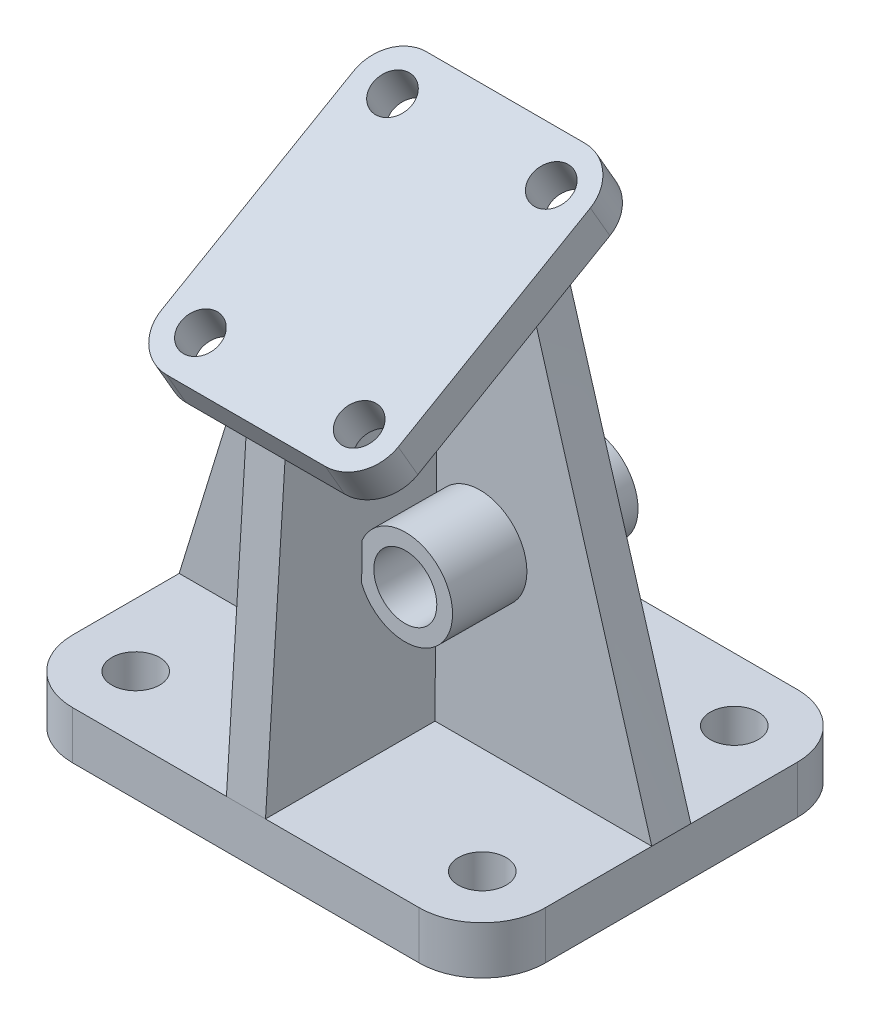
from build123d import *

# Parameters (mm, degrees)
SKETCH7_R           = 4.826
BOSS_EXTRUDE2_DEPTH = 9.652
SKETCH11_R          = 3.937
BOSS_EXTRUDE3_DEPTH = 7.874
RIB1_REACH          = 117.25
SKETCH16_WALL_W     = 293.372991472
SKETCH16_WALL_H     = 7.874
SKETCH17_R          = 9.525
SKETCH17_R_2        = 6.35
BOSS_EXTRUDE4_DEPTH = 14.986
SKETCH18_R          = 9.525
SKETCH18_R_2        = 6.35
BOSS_EXTRUDE5_DEPTH = 14.986


with BuildPart() as part:
    # Sketch7 → Boss-Extrude2 (new body)
    with BuildSketch(Plane(origin=(0, 0, 0), x_dir=(1, 0, 0), z_dir=(0, 1, 0))):
        with BuildLine():
            Line((-34.925, 38.1), (34.925, 38.1))
            ThreePointArc((34.925, 38.1), (43.905256121, 34.380256121), (47.625, 25.4))
            Line((47.625, 25.4), (47.625, -25.4))
            ThreePointArc((47.625, -25.4), (43.905256121, -34.380256121), (34.925, -38.1))
            Line((34.925, -38.1), (-34.925, -38.1))
            ThreePointArc((-34.925, -38.1), (-43.905256121, -34.380256121), (-47.625, -25.4))
            Line((-47.625, -25.4), (-47.625, 25.4))
            ThreePointArc((-47.625, 25.4), (-43.905256121, 34.380256121), (-34.925, 38.1))
        make_face()
        with Locations(Location((-34.925, 25.4, 0), (0, 0, 270))):
            Circle(SKETCH7_R, mode=Mode.SUBTRACT)
        with Locations(Location((34.925, 25.4, 0), (0, 0, 90))):
            Circle(SKETCH7_R, mode=Mode.SUBTRACT)
        with Locations(Location((34.925, -25.4, 0), (0, 0, 270))):
            Circle(SKETCH7_R, mode=Mode.SUBTRACT)
        with Locations(Location((-34.925, -25.4, 0), (0, 0, 90))):
            Circle(SKETCH7_R, mode=Mode.SUBTRACT)
    extrude(amount=-BOSS_EXTRUDE2_DEPTH)



with BuildPart() as body_2:
    # Sketch11 → Boss-Extrude3 (new body)
    with BuildSketch(Plane(origin=(0, 67.170783942, 38.781070191), x_dir=(0, 0.4999999999999983, -0.8660254037844396), z_dir=(0, -0.8660254037844396, -0.4999999999999983))):
        with BuildLine():
            Line((53.364432116, -23.876), (8.660432116, -23.876))
            ThreePointArc((8.660432116, -23.876), (3.092673321, -21.569758795), (0.786432116, -16.002))
            Line((0.786432116, -16.002), (0.786432116, 16.002))
            ThreePointArc((0.786432116, 16.002), (3.092673321, 21.569758795), (8.660432116, 23.876))
            Line((8.660432116, 23.876), (53.364432116, 23.876))
            ThreePointArc((53.364432116, 23.876), (58.932190911, 21.569758795), (61.238432116, 16.002))
            Line((61.238432116, 16.002), (61.238432116, -16.002))
            ThreePointArc((61.238432116, -16.002), (58.932190911, -21.569758795), (53.364432116, -23.876))
        make_face()
        with Locations((53.364432116, -16.002)):
            Circle(SKETCH11_R, mode=Mode.SUBTRACT)
        with Locations(Location((8.660432116, -16.002, 0), (0, 0, 180))):
            Circle(SKETCH11_R, mode=Mode.SUBTRACT)
        with Locations(Location((53.364432116, 16.002, 0), (0, 0, 180))):
            Circle(SKETCH11_R, mode=Mode.SUBTRACT)
        with Locations((8.660432116, 16.002)):
            Circle(SKETCH11_R, mode=Mode.SUBTRACT)
    extrude(amount=BOSS_EXTRUDE3_DEPTH)


with BuildPart() as part_1:
    add(part.part)

    add(body_2.part)  # Loft1 merges body 2
    # Sketch15 → Loft1 section 0
    with BuildSketch(Plane(origin=(0, 60.351699913, 34.844070191), x_dir=(1, 0, 0), z_dir=(0, -0.8660254037844397, -0.4999999999999983))):
        with BuildLine():
            Line((23.876, -36.297466608), (-23.876, -36.297466608))
            Line((-23.876, -36.297466608), (-23.876, -44.171466608))
            Line((-23.876, -44.171466608), (23.876, -44.171466608))
            Line((23.876, -44.171466608), (23.876, -36.297466608))
        make_face()
    # Sketch12 → Loft1 section 1
    with BuildSketch(Plane(origin=(0, 0, 0), x_dir=(1, 0, 0), z_dir=(0, 1, 0))):
        with BuildLine():
            Line((-47.625, 3.937), (47.625, 3.937))
            Line((47.625, 3.937), (47.625, -3.937))
            Line((47.625, -3.937), (-47.625, -3.937))
            Line((-47.625, -3.937), (-47.625, 3.937))
        make_face()
    loft()

    # Sketch16 wall → Rib1 (add, up to next)
    with BuildSketch(Plane(origin=(0, 30.372457985, 36.1315), x_dir=(0, 0.997906295589, -0.064676311144), z_dir=(0, 0.064676311144, 0.997906295589)), mode=Mode.PRIVATE) as rib1_sk1:
        Rectangle(SKETCH16_WALL_W, SKETCH16_WALL_H)
    rib1_tool1 = extrude(rib1_sk1.sketch, amount=-RIB1_REACH, mode=Mode.PRIVATE) - part_1.part
    add(rib1_tool1.solids().sort_by_distance((0, 30.372457985, 36.1315))[0])

    # Sketch17 → Boss-Extrude4 (add)
    with BuildSketch(Plane(origin=(0, 0.02645219, 3.936822263), x_dir=(1, 0, 0), z_dir=(0, 0.0067190212517474575, 0.9999774271219419))):
        with Locations((12.7, 35.025547213)):
            Circle(SKETCH17_R)
        with Locations(Location((12.7, 35.025547213, 0), (0, 0, 270))):
            Circle(SKETCH17_R_2, mode=Mode.SUBTRACT)
    extrude(amount=BOSS_EXTRUDE4_DEPTH)

    # Sketch18 → Boss-Extrude5 (add)
    with BuildSketch(Plane(origin=(0, 0.025189007, -3.936838834), x_dir=(-1, 0, 0), z_dir=(0, 0.006398151525432763, -0.9999795316190516))):
        with Locations(Location((-12.7, 34.808230427, 0), (0, 0, 90))):
            Circle(SKETCH18_R)
        with Locations(Location((-12.7, 34.808230427, 0), (0, 0, 90))):
            Circle(SKETCH18_R_2, mode=Mode.SUBTRACT)
    extrude(amount=BOSS_EXTRUDE5_DEPTH)


solid = part_1.part
